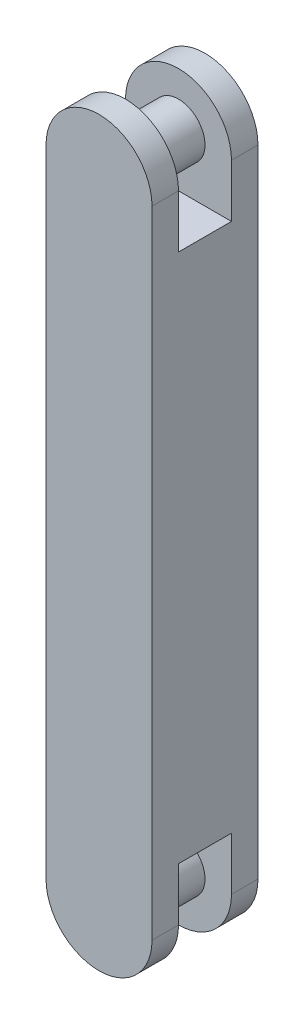
from build123d import *

# Parameters (mm, degrees)
SKETCH1_R                       = 12.7
BOSS_EXTRUDE1_DEPTH             = 25.4
CUT_EXTRUDE1_DEPTH              = 333.148099498
CUT_EXTRUDE1_DEPTH_BACK         = 333.148099498
SKETCH2_W                       = 25.4
SKETCH2_H                       = 50.8
BOSS_EXTRUDE2_REACH             = 334.148
SKETCH1_2_R                     = 12.7
BOSS_EXTRUDE2_DIRECTION_2_REACH = 334.148


with BuildPart() as part:
    # Sketch1 → Boss-Extrude1 (new, symmetric)
    with BuildSketch(Plane.XY):
        with BuildLine():
            Line((-25.4, 0), (-25.4, 304.8))
            ThreePointArc((-25.4, 304.8), (0, 330.2), (25.4, 304.8))
            Line((25.4, 304.8), (25.4, 0))
            ThreePointArc((25.4, 0), (0, -25.4), (-25.4, 0))
        make_face()
        Circle(SKETCH1_R, mode=Mode.SUBTRACT)
        with Locations((0, 304.8)):
            Circle(SKETCH1_R, mode=Mode.SUBTRACT)
    extrude(amount=BOSS_EXTRUDE1_DEPTH, both=True)

    # Sketch2 → Cut-Extrude1 (cut, two sides: drawn at the far end of the back side and taken through both)
    with BuildSketch(Plane(origin=(0, 0, 0), x_dir=(0, 0, -1), z_dir=(1, 0, 0)).offset(-CUT_EXTRUDE1_DEPTH_BACK)):
        with Locations((0, 304.8)):
            Rectangle(SKETCH2_W, SKETCH2_H)
        Rectangle(SKETCH2_W, SKETCH2_H)
    extrude(amount=CUT_EXTRUDE1_DEPTH + CUT_EXTRUDE1_DEPTH_BACK, mode=Mode.SUBTRACT)

    # Boss-Extrude2: up to this face of the body (flat: up to its plane)
    boss_extrude2_end = Plane(part.part.faces().sort_by_distance((0, 152.4, -25.4))[0])
    # Sketch1<2> → Boss-Extrude2 (add, up to the picked face)
    with BuildSketch(Plane.XY, mode=Mode.PRIVATE) as boss_extrude2_sk1:
        Circle(SKETCH1_2_R)
    boss_extrude2_tool1 = split(extrude(boss_extrude2_sk1.sketch, amount=-BOSS_EXTRUDE2_REACH, mode=Mode.PRIVATE), bisect_by=boss_extrude2_end, keep=Keep.BOTH, mode=Mode.PRIVATE)
    # Sketch1<2> → Boss-Extrude2 (add, up to the picked face)
    with BuildSketch(Plane.XY, mode=Mode.PRIVATE) as boss_extrude2_sk2:
        with Locations((0, 304.8)):
            Circle(SKETCH1_2_R)
    boss_extrude2_tool2 = split(extrude(boss_extrude2_sk2.sketch, amount=-BOSS_EXTRUDE2_REACH, mode=Mode.PRIVATE), bisect_by=boss_extrude2_end, keep=Keep.BOTH, mode=Mode.PRIVATE)
    add(boss_extrude2_tool1.solids().sort_by(Axis((0, 0, 0), (0, 0, -1)))[0])
    add(boss_extrude2_tool2.solids().sort_by(Axis((0, 304.8, 0), (0, 0, -1)))[0])

    # Boss-Extrude2 direction 2: up to this face of the body (flat: up to its plane)
    boss_extrude2_direction_2_end = Plane(part.part.faces().sort_by_distance((0, 152.4, 25.4))[0])
    # Sketch1<2> → Boss-Extrude2 direction 2 (add, up to the picked face)
    with BuildSketch(Plane.XY, mode=Mode.PRIVATE) as boss_extrude2_direction_2_sk1:
        Circle(SKETCH1_2_R)
    boss_extrude2_direction_2_tool1 = split(extrude(boss_extrude2_direction_2_sk1.sketch, amount=BOSS_EXTRUDE2_DIRECTION_2_REACH, mode=Mode.PRIVATE), bisect_by=boss_extrude2_direction_2_end, keep=Keep.BOTH, mode=Mode.PRIVATE)
    # Sketch1<2> → Boss-Extrude2 direction 2 (add, up to the picked face)
    with BuildSketch(Plane.XY, mode=Mode.PRIVATE) as boss_extrude2_direction_2_sk2:
        with Locations((0, 304.8)):
            Circle(SKETCH1_2_R)
    boss_extrude2_direction_2_tool2 = split(extrude(boss_extrude2_direction_2_sk2.sketch, amount=BOSS_EXTRUDE2_DIRECTION_2_REACH, mode=Mode.PRIVATE), bisect_by=boss_extrude2_direction_2_end, keep=Keep.BOTH, mode=Mode.PRIVATE)
    add(boss_extrude2_direction_2_tool1.solids().sort_by(Axis((0, 0, 0), (0, 0, 1)))[0])
    add(boss_extrude2_direction_2_tool2.solids().sort_by(Axis((0, 304.8, 0), (0, 0, 1)))[0])


solid = part.part
